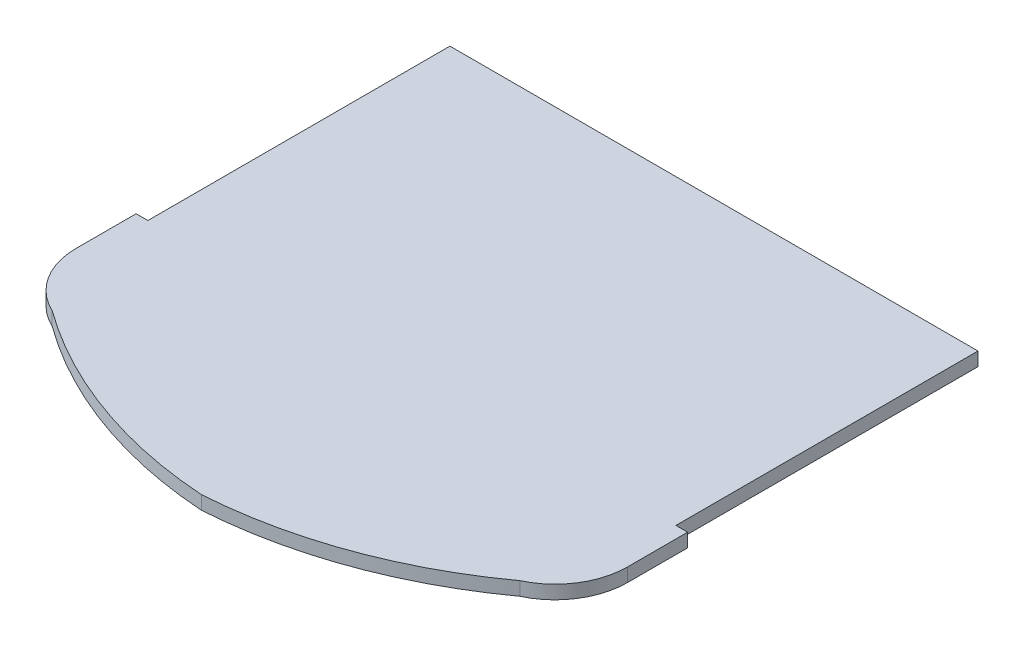
from build123d import *

# Parameters (mm, degrees)
BOSS_EXTRUDE3_DEPTH = 11.43


with BuildPart() as part:
    # Sketch22 → Boss-Extrude3 (new, symmetric)
    with BuildSketch(Plane(origin=(0, 0, 0), x_dir=(1, 0, 0), z_dir=(0, 1, 0))):
        with BuildLine():
            Line((444.5, 0), (-444.5, 0))
            Line((-444.5, 0), (-444.5, -508.5588))
            Line((-444.5, -508.5588), (-464.2612, -508.5588))
            Line((-464.2612, -508.5588), (-464.2612, -609.6))
            ThreePointArc((-464.2612, -609.6), (-445.093816183, -675.319055068), (-393.602166776, -720.429950012))
            ThreePointArc((-393.602166776, -720.429950012), (-206.914351562, -819.647480117), (0, -863.039988079))
            ThreePointArc((0, -863.039988079), (206.914351562, -819.647480117), (393.602166776, -720.429950012))
            ThreePointArc((393.602166776, -720.429950012), (445.093816183, -675.319055068), (464.2612, -609.6))
            Line((464.2612, -609.6), (464.2612, -508.5588))
            Line((464.2612, -508.5588), (444.5, -508.5588))
            Line((444.5, -508.5588), (444.5, 0))
        make_face()
    extrude(amount=BOSS_EXTRUDE3_DEPTH, both=True)


solid = part.part
